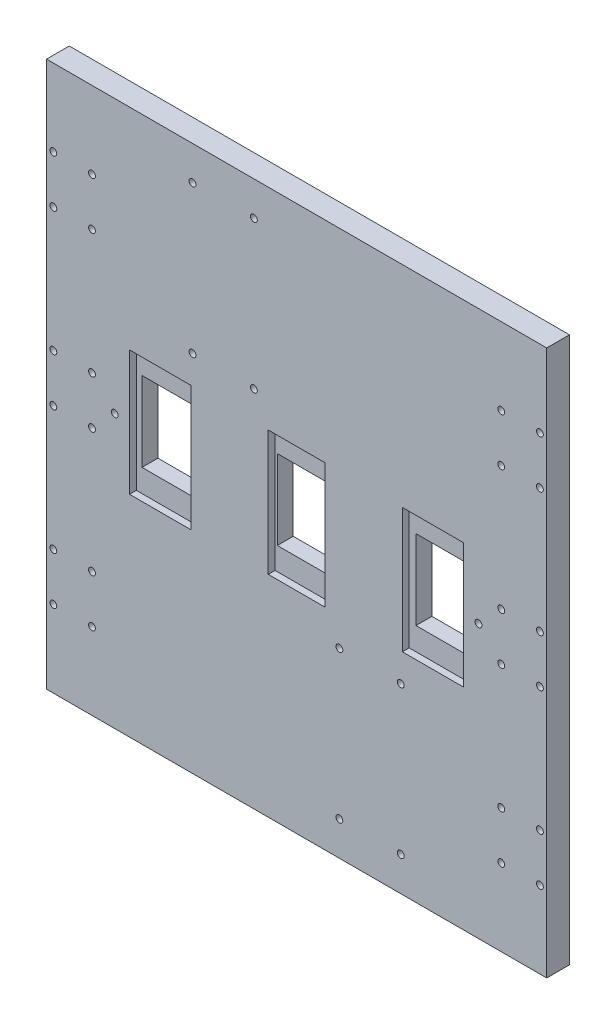
from build123d import *

# Parameters (mm, degrees)
SKETCH1_W               = 220
SKETCH1_H               = 240
SKETCH1_R               = 1.5
SKETCH1_W_2             = 19
SKETCH1_H_2             = 35
BOSS_EXTRUDE1_DEPTH     = 10
CUT_EXTRUDE1_DEPTH      = 164.095064303
CUT_EXTRUDE1_DEPTH_BACK = 3
SKETCH2_W               = 147
SKETCH2_H               = 55
SKETCH3_W               = 34
SKETCH3_H               = 55
BOSS_EXTRUDE2_DEPTH     = 3
SKETCH6_W               = 2.5
SKETCH6_H               = 35
CUT_EXTRUDE3_DEPTH      = 10
SKETCH7_W               = 2
SKETCH7_H               = 35
CUT_EXTRUDE4_DEPTH      = 10


with BuildPart() as part:
    # Sketch1 → Boss-Extrude1 (new body)
    with BuildSketch(Plane.XY):
        Rectangle(SKETCH1_W, SKETCH1_H)
        with Locations((18.8, -40)):
            Circle(SKETCH1_R, mode=Mode.SUBTRACT)
        with Locations((45.8, -40)):
            Circle(SKETCH1_R, mode=Mode.SUBTRACT)
        with Locations((45.8, -105)):
            Circle(SKETCH1_R, mode=Mode.SUBTRACT)
        with Locations((18.8, -105)):
            Circle(SKETCH1_R, mode=Mode.SUBTRACT)
        with Locations((-45.8, 105)):
            Circle(SKETCH1_R, mode=Mode.SUBTRACT)
        with Locations((-18.8, 105)):
            Circle(SKETCH1_R, mode=Mode.SUBTRACT)
        with Locations((-18.8, 40)):
            Circle(SKETCH1_R, mode=Mode.SUBTRACT)
        with Locations((-45.8, 40)):
            Circle(SKETCH1_R, mode=Mode.SUBTRACT)
        with Locations((-80, 0)):
            Circle(SKETCH1_R, mode=Mode.SUBTRACT)
        with Locations((80, 0)):
            Circle(SKETCH1_R, mode=Mode.SUBTRACT)
        with Locations((90, 86.169859373)):
            Circle(SKETCH1_R, mode=Mode.SUBTRACT)
        with Locations((90, 65.169859373)):
            Circle(SKETCH1_R, mode=Mode.SUBTRACT)
        with Locations((107, 65.169859373)):
            Circle(SKETCH1_R, mode=Mode.SUBTRACT)
        with Locations((107, 86.169859373)):
            Circle(SKETCH1_R, mode=Mode.SUBTRACT)
        with Locations((90, -10.5)):
            Circle(SKETCH1_R, mode=Mode.SUBTRACT)
        with Locations((90, 10.5)):
            Circle(SKETCH1_R, mode=Mode.SUBTRACT)
        with Locations((107, 10.5)):
            Circle(SKETCH1_R, mode=Mode.SUBTRACT)
        with Locations((107, -10.5)):
            Circle(SKETCH1_R, mode=Mode.SUBTRACT)
        with Locations((90, -86.169859373)):
            Circle(SKETCH1_R, mode=Mode.SUBTRACT)
        with Locations((90, -65.169859373)):
            Circle(SKETCH1_R, mode=Mode.SUBTRACT)
        with Locations((107, -65.169859373)):
            Circle(SKETCH1_R, mode=Mode.SUBTRACT)
        with Locations((107, -86.169859373)):
            Circle(SKETCH1_R, mode=Mode.SUBTRACT)
        with Locations((-107, -65.169859373)):
            Circle(SKETCH1_R, mode=Mode.SUBTRACT)
        with Locations((-107, -86.169859373)):
            Circle(SKETCH1_R, mode=Mode.SUBTRACT)
        with Locations((-90, -86.169859373)):
            Circle(SKETCH1_R, mode=Mode.SUBTRACT)
        with Locations((-90, -65.169859373)):
            Circle(SKETCH1_R, mode=Mode.SUBTRACT)
        with Locations((-107, -10.5)):
            Circle(SKETCH1_R, mode=Mode.SUBTRACT)
        with Locations((-107, 10.5)):
            Circle(SKETCH1_R, mode=Mode.SUBTRACT)
        with Locations((-90, 10.5)):
            Circle(SKETCH1_R, mode=Mode.SUBTRACT)
        with Locations((-90, -10.5)):
            Circle(SKETCH1_R, mode=Mode.SUBTRACT)
        with Locations((-107, 86.169859373)):
            Circle(SKETCH1_R, mode=Mode.SUBTRACT)
        with Locations((-107, 65.169859373)):
            Circle(SKETCH1_R, mode=Mode.SUBTRACT)
        with Locations((-90, 65.169859373)):
            Circle(SKETCH1_R, mode=Mode.SUBTRACT)
        with Locations((-90, 86.169859373)):
            Circle(SKETCH1_R, mode=Mode.SUBTRACT)
        with Locations((-59, 0)):
            Rectangle(SKETCH1_W_2, SKETCH1_H_2, mode=Mode.SUBTRACT)
        with Locations((59, 0)):
            Rectangle(SKETCH1_W_2, SKETCH1_H_2, mode=Mode.SUBTRACT)
        Rectangle(SKETCH1_W_2, SKETCH1_H_2, mode=Mode.SUBTRACT)
    extrude(amount=BOSS_EXTRUDE1_DEPTH)

    # Sketch2 → Cut-Extrude1 (cut, two sides: drawn at the far end of the back side and taken through both)
    with BuildSketch(Plane.XY.offset(10).offset(-CUT_EXTRUDE1_DEPTH_BACK)):
        Rectangle(SKETCH2_W, SKETCH2_H)
    extrude(amount=CUT_EXTRUDE1_DEPTH + CUT_EXTRUDE1_DEPTH_BACK, mode=Mode.SUBTRACT)

    # Sketch3 → Boss-Extrude2 (add)
    with BuildSketch(Plane.XY.offset(7)):
        with Locations((29.5, 0)):
            Rectangle(SKETCH3_W, SKETCH3_H)
        with Locations((-29.5, 0)):
            Rectangle(SKETCH3_W, SKETCH3_H)
    extrude(amount=BOSS_EXTRUDE2_DEPTH)

    # Sketch6 → Cut-Extrude3 (cut)
    with BuildSketch(Plane.XY.offset(7)):
        with Locations((-69.75, 0)):
            Rectangle(SKETCH6_W, SKETCH6_H)
        with Locations((69.75, 0)):
            Rectangle(SKETCH6_W, SKETCH6_H)
    extrude(amount=-CUT_EXTRUDE3_DEPTH, mode=Mode.SUBTRACT)

    # Sketch7 → Cut-Extrude4 (cut)
    with BuildSketch(Plane.XY.offset(7)):
        with Locations((10.5, 0)):
            Rectangle(SKETCH7_W, SKETCH7_H)
        with Locations((-10.5, 0)):
            Rectangle(SKETCH7_W, SKETCH7_H)
    extrude(amount=-CUT_EXTRUDE4_DEPTH, mode=Mode.SUBTRACT)


solid = part.part
